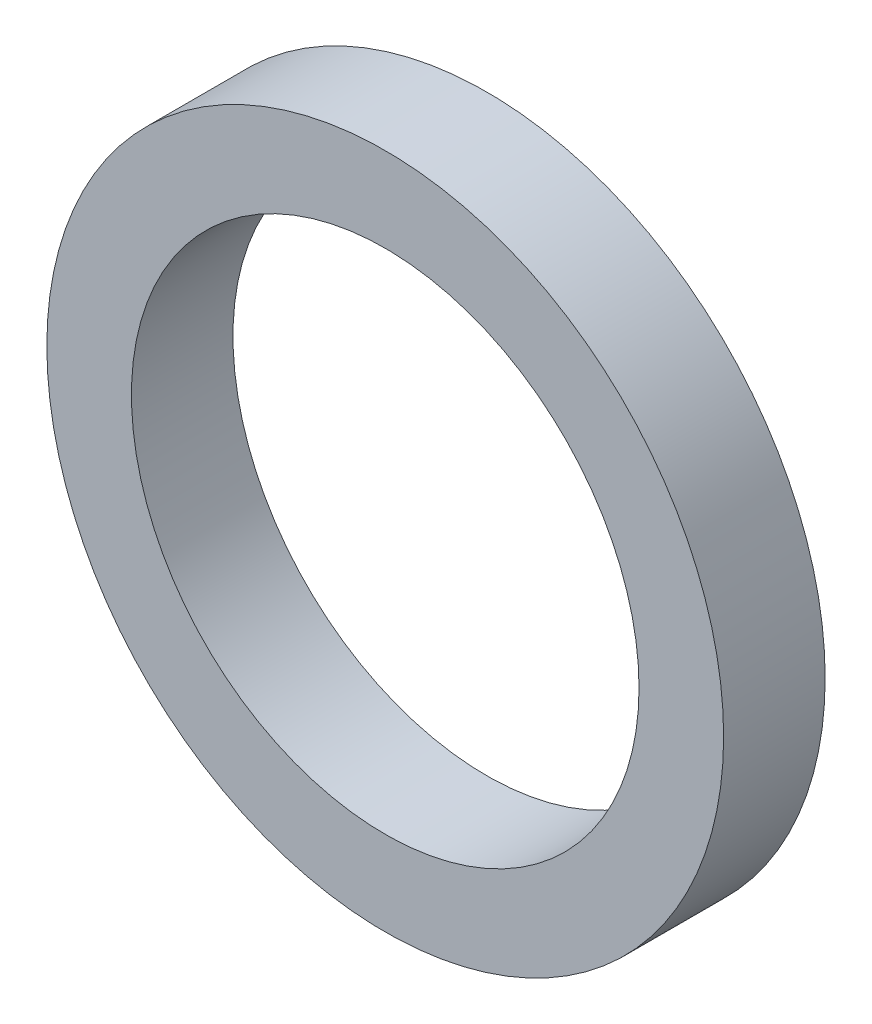
from build123d import *

# Parameters (mm, degrees)
ESQUISSE1_R      = 20
ESQUISSE1_R_2    = 15
EXTRUSION1_DEPTH = 6


with BuildPart() as part:
    # Esquisse1 → Extrusion1 (new body)
    with BuildSketch(Plane.XY):
        Circle(ESQUISSE1_R)
        Circle(ESQUISSE1_R_2, mode=Mode.SUBTRACT)
    extrude(amount=EXTRUSION1_DEPTH)


solid = part.part
